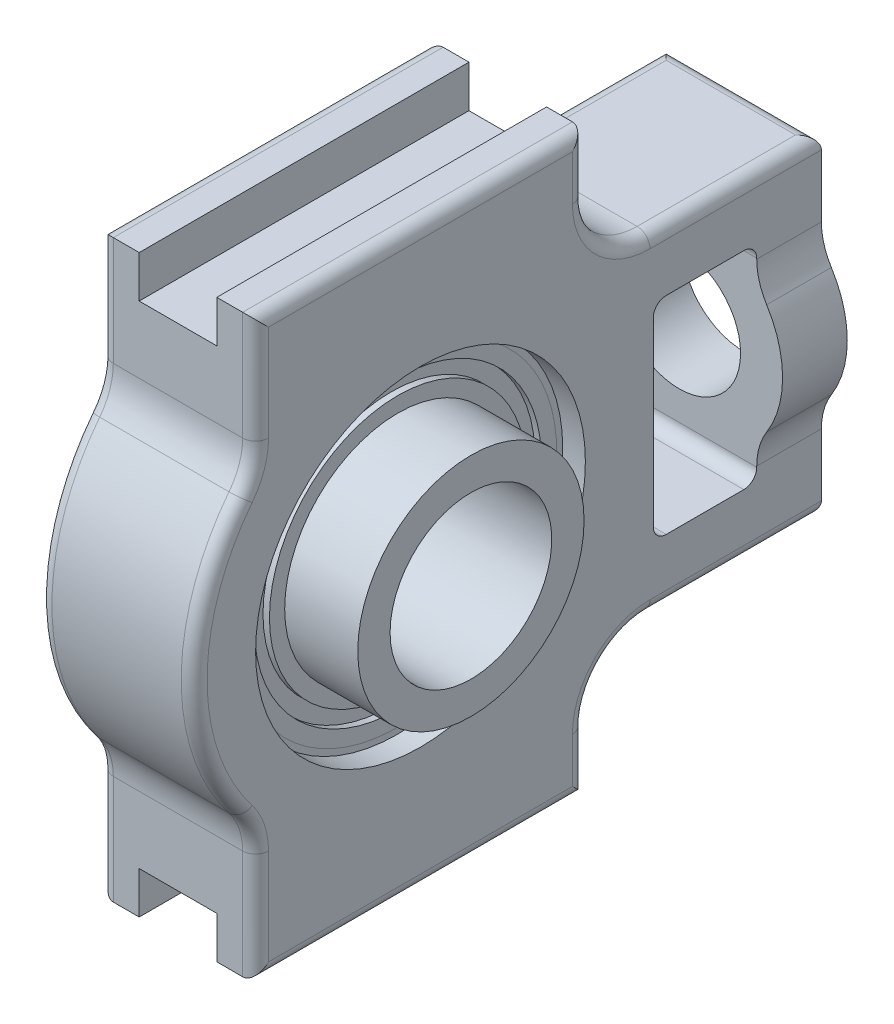
from build123d import *

# Parameters (mm, degrees)
SKETCH1_W      = 16
SKETCH1_H      = 32
EXTRUDE1_DEPTH = 12
EXTRUDE2_START = -10
SKETCH2_R      = 16
EXTRUDE2_DEPTH = 10
EXTRUDE3_REACH = 109.913
SKETCH3_R      = 9.5
SKETCH4_W      = 12
SKETCH4_H      = 6.5
EXTRUDE4_DEPTH = 77.788671039
FILLET1_R      = 10
FILLET2_R      = 2


with BuildPart() as part:
    # Sketch1 → Extrude1 (new, symmetric)
    with BuildSketch(Plane(origin=(0, 0, 0), x_dir=(0, 0, -1), z_dir=(1, 0, 0))):
        with BuildLine():
            Line((25.5, 25.5), (25.5, 44.5))
            Line((25.5, 44.5), (-25.5, 44.5))
            Line((-25.5, 44.5), (-25.5, 23.973944189))
            ThreePointArc((-25.5, 23.973944189), (-35, 0), (-25.5, -23.973944189))
            Line((-25.5, -23.973944189), (-25.5, -44.5))
            Line((-25.5, -44.5), (25.5, -44.5))
            Line((25.5, -44.5), (25.5, -25.5))
            Line((25.5, -25.5), (62, -25.5))
            Line((62, -25.5), (62, 25.5))
            Line((62, 25.5), (25.5, 25.5))
        make_face()
        with Locations((44, 0)):
            Rectangle(SKETCH1_W, SKETCH1_H, mode=Mode.SUBTRACT)
    extrude(amount=EXTRUDE1_DEPTH, both=True)

    # Sketch2 → Extrude2 (add)
    with BuildSketch(Plane(origin=(0, 0, -62), x_dir=(-1, 0, 0), z_dir=(0, 0, -1)).offset(EXTRUDE2_START)):
        Circle(SKETCH2_R)
    extrude(amount=EXTRUDE2_DEPTH)

    # Sketch3 → Extrude3 (cut, up to next)
    with BuildSketch(Plane(origin=(0, 0, -62), x_dir=(-1, 0, 0), z_dir=(0, 0, -1)), mode=Mode.PRIVATE) as extrude3_sk1:
        Circle(SKETCH3_R)
    extrude3_tool1 = extrude(extrude3_sk1.sketch, amount=-EXTRUDE3_REACH, mode=Mode.PRIVATE) & part.part
    add(extrude3_tool1.solids().sort_by_distance((0, 0, -62))[0], mode=Mode.SUBTRACT)

    # Sketch4 → Extrude4 (cut, through all)
    with BuildSketch(Plane(origin=(0, 0, -25.5), x_dir=(-1, 0, 0), z_dir=(0, 0, -1))):
        with Locations((0, 41.25)):
            Rectangle(SKETCH4_W, SKETCH4_H)
        with Locations((0, -41.25)):
            Rectangle(SKETCH4_W, SKETCH4_H)
    extrude(amount=-EXTRUDE4_DEPTH, mode=Mode.SUBTRACT)

    # Sketch5 → Cut-Revolve1 (revolve, cut)
    with BuildSketch(Plane.XY, mode=Mode.PRIVATE) as cut_revolve1_sk:
        with BuildLine():
            Line((8.5, 25.5), (8.5, 24.571324751))
            ThreePointArc((8.5, 24.571324751), (0, 26), (-8.5, 24.571324751))
            Line((-8.5, 24.571324751), (-8.5, 25.5))
            Line((-8.5, 25.5), (-12, 25.5))
            Line((-12, 25.5), (-12, 0))
            Line((-12, 0), (12, 0))
            Line((12, 0), (12, 25.5))
            Line((12, 25.5), (8.5, 25.5))
        make_face()
    revolve(cut_revolve1_sk.sketch.rotate(Axis((19.865799579, 0, 0), (-1, 0, 0)), 90), axis=Axis((19.865799579, 0, 0), (-1, 0, 0)), mode=Mode.SUBTRACT)

    # Fillet1
    fillet1_edges = [part.edges().sort_by_distance(p)[0] for p in [
        (0, 25.5, -25.5),
        (0, -25.5, -25.5),
        (0, -23.973944189, 25.5),
        (0, 23.973944189, 25.5),
        (-12, -10.583005244, -57),
        (-12, 10.583005244, -57),
        (12, -10.583005244, -57),
        (12, 10.583005244, -57),
    ]]
    fillet(fillet1_edges, radius=FILLET1_R)

    # Fillet2
    fillet2_edges = [part.edges().sort_by_distance(p)[0] for p in [
        (-12, -40, -25.5),
        (-12, -44.5, 0),
        (12, -36.077056809, 25.5),
        (-12, -36.077056809, 25.5),
        (-12, 0, 35),
        (12, 0, 35),
        (-12, -25.5, -48.75),
        (12, -25.5, -48.75),
        (12, 40, -25.5),
        (-12, 40, -25.5),
        (-12, 36.077056809, 25.5),
        (-12, 44.5, 0),
        (-12, -24.40518217, 26.042492694),
        (12, -24.40518217, 26.042492694),
        (-12, 24.40518217, 26.042492694),
        (12, 24.40518217, 26.042492694),
        (-12, -28.428932188, -28.428932188),
        (12, -28.428932188, -28.428932188),
        (-12, 28.428932188, -28.428932188),
        (12, 28.428932188, -28.428932188),
        (12, -44.5, 0),
        (0, 25.5, -62),
        (0, -25.5, -62),
        (12, -40, -25.5),
        (12, 25.5, -48.75),
        (0, -16, -52),
        (0, 16, -52),
        (0, 16, -36),
        (0, -16, -36),
        (12, 44.5, 0),
        (12, 36.077056809, 25.5),
        (-12, 25.5, -48.75),
    ]]
    fillet(fillet2_edges, radius=FILLET2_R)


with BuildPart() as body_2:
    # Sketch7 → Revolve1 (revolve)
    with BuildSketch(Plane.XY, mode=Mode.PRIVATE) as revolve1_sk:
        with BuildLine():
            Line((-8.5, 24.571324751), (-8.5, 22.2142165))
            Line((-8.5, 22.2142165), (-7.5, 22.2142165))
            Line((-7.5, 22.2142165), (-7.5, 19.85710825))
            Line((-7.5, 19.85710825), (-8.5, 19.85710825))
            Line((-8.5, 19.85710825), (-8.5, 17.5))
            Line((-8.5, 17.5), (-14.3, 17.5))
            Line((-14.3, 17.5), (-14.3, 12.5))
            Line((-14.3, 12.5), (19.8, 12.5))
            Line((19.8, 12.5), (19.8, 17.5))
            Line((19.8, 17.5), (8.5, 17.5))
            Line((8.5, 17.5), (8.5, 19.85710825))
            Line((8.5, 19.85710825), (7.5, 19.85710825))
            Line((7.5, 19.85710825), (7.5, 22.2142165))
            Line((7.5, 22.2142165), (8.5, 22.2142165))
            Line((8.5, 22.2142165), (8.5, 24.571324751))
            ThreePointArc((8.5, 24.571324751), (0, 26), (-8.5, 24.571324751))
        make_face()
    revolve(revolve1_sk.sketch.rotate(Axis((0, 0, 0), (1, 0, 0)), 90), axis=Axis((0, 0, 0), (1, 0, 0)))


solid = Compound([part.part, body_2.part])
